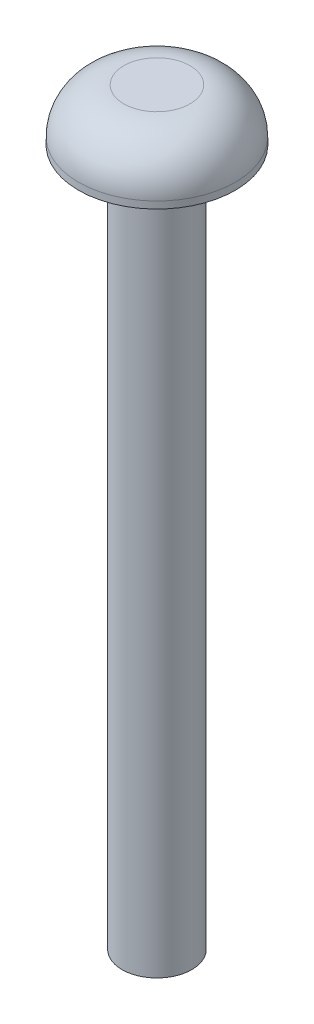
from build123d import *

# Parameters (mm, degrees)
SKETCH1_R           = 2
BOSS_EXTRUDE1_DEPTH = 40
SKETCH2_R           = 4.5
BOSS_EXTRUDE2_DEPTH = 3
FILLET1_R           = 2.6


with BuildPart() as part:
    # Sketch1 → Boss-Extrude1 (new body)
    with BuildSketch(Plane(origin=(0, 0, 0), x_dir=(1, 0, 0), z_dir=(0, 1, 0))):
        with Locations(Location((0, 0, 0), (0, 0, 270))):
            Circle(SKETCH1_R)
    extrude(amount=BOSS_EXTRUDE1_DEPTH)

    # Sketch2 → Boss-Extrude2 (add)
    with BuildSketch(Plane(origin=(0, 40, 0), x_dir=(1, 0, 0), z_dir=(0, 1, 0))):
        with Locations(Location((0, 0, 0), (0, 0, 270))):
            Circle(SKETCH2_R)
    extrude(amount=BOSS_EXTRUDE2_DEPTH)

    # Fillet1
    fillet1_edges = [part.edges().sort_by_distance(p)[0] for p in [
        (0, 43, -4.5),
    ]]
    fillet(fillet1_edges, radius=FILLET1_R)


solid = part.part
